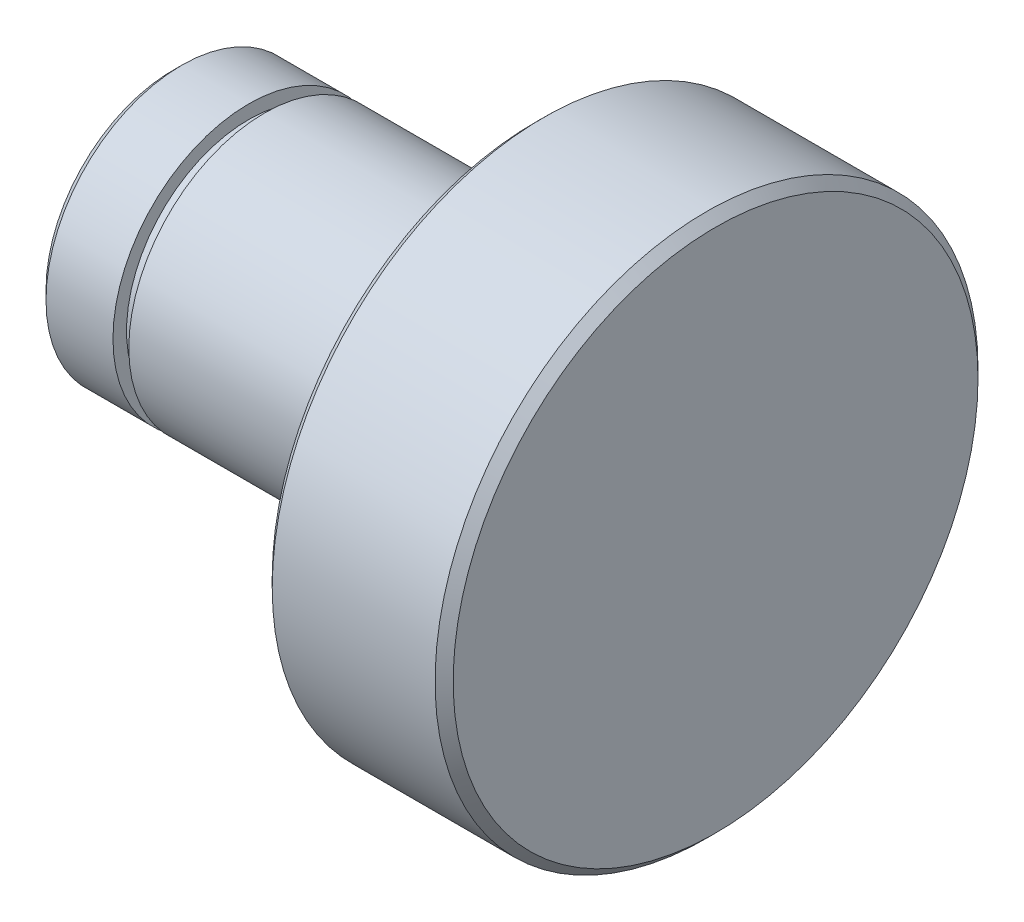
from build123d import *

# Parameters (mm, degrees)
SMUSSO1_SIZE = 1
SCHIZZO5_W   = 1.6
SCHIZZO5_H   = 4.170885387
SCHIZZO5_W_2 = 0.15


with BuildPart() as part:
    # Schizzo1 → Rivoluzione1 (revolve)
    with BuildSketch(Plane.XY, mode=Mode.PRIVATE) as rivoluzione1_sk:
        Polygon((0, 0), (0, 30), (-20, 30), (-20, 15), (-60, 15), (-60, 0), align=None)
    revolve(rivoluzione1_sk.sketch.rotate(Axis((0, 0, 0), (-1, 0, 0)), 90), axis=Axis((0, 0, 0), (-1, 0, 0)))

    # Smusso1
    smusso1_edges = [part.edges().sort_by_distance(p)[0] for p in [
        (-60, 0, 15),
        (-20, 0, 30),
        (0, 0, 30),
    ]]
    chamfer(smusso1_edges, length=SMUSSO1_SIZE)

    # Schizzo5 → Taglia-Rivoluzione7 (revolve, cut)
    with BuildSketch(Plane.XY, mode=Mode.PRIVATE) as taglia_rivoluzione7_sk:
        with Locations((-50.8, 15.585442694)):
            Rectangle(SCHIZZO5_W, SCHIZZO5_H)
        with Locations((-49.925, 15.585442694)):
            Rectangle(SCHIZZO5_W_2, SCHIZZO5_H)
    revolve(taglia_rivoluzione7_sk.sketch.rotate(Axis((0, 0, 0), (-1, 0, 0)), 270), axis=Axis((0, 0, 0), (-1, 0, 0)), mode=Mode.SUBTRACT)


solid = part.part
